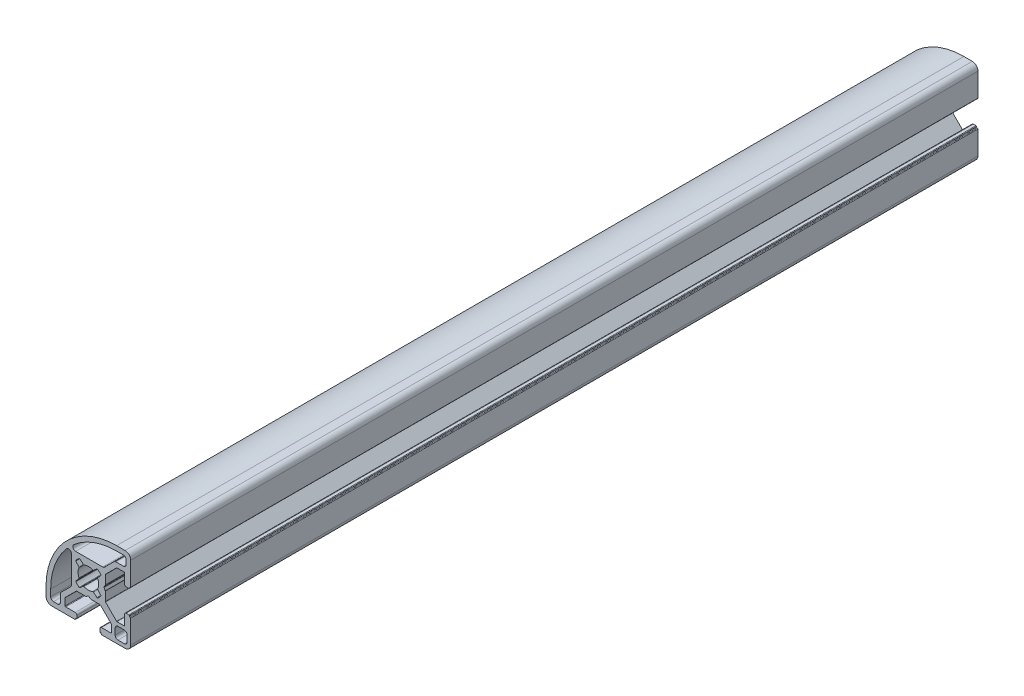
from build123d import *

# Parameters (mm, degrees)
EXTRUDE1_DEPTH = 300


with BuildPart() as part:
    # Sketch1 → Extrude1 (new body)
    with BuildSketch(Plane.XY):
        with BuildLine():
            Line((5.977671173, -0.853590033), (5.542585895, -0.100000184))
            ThreePointArc((5.542585895, -0.100000184), (5.515790979, -1.84e-07), (5.5425859, 0.099999816))
            Line((5.5425859, 0.099999816), (5.977671215, 0.853589644))
            ThreePointArc((5.977671215, 0.853589644), (5.9976513, 0.901825834), (6.004466136, 0.953589643))
            Line((6.004466136, 0.953589643), (6.004466136, 4.121623186))
            ThreePointArc((6.004466136, 4.121623186), (6.019690232, 4.198159872), (6.063044784, 4.263044541))
            Line((6.063044784, 4.263044541), (9.991421498, 8.191421063))
            ThreePointArc((9.991421498, 8.191421063), (10.056306169, 8.234775612), (10.132842855, 8.249999704))
            Line((10.132842855, 8.249999704), (12.600000143, 8.249999704))
            ThreePointArc((12.600000143, 8.249999704), (12.741421498, 8.191421057), (12.800000138, 8.049999699))
            Line((12.800000138, 8.049999699), (12.800000138, 4.649999699))
            ThreePointArc((12.800000138, 4.649999699), (12.975736059, 4.225735626), (13.400000123, 4.049999684))
            Line((13.400000123, 4.049999684), (14.300000123, 4.049999684))
            ThreePointArc((14.300000123, 4.049999684), (14.441421481, 4.108578325), (14.500000128, 4.249999679))
            Line((14.500000128, 4.249999679), (14.500000128, 4.349999679))
            ThreePointArc((14.500000128, 4.349999679), (14.558578775, 4.491421034), (14.700000133, 4.549999675))
            Line((14.700000133, 4.549999675), (14.800000133, 4.549999675))
            ThreePointArc((14.800000133, 4.549999675), (14.941421467, 4.608578371), (15.000000058, 4.749999749))
            Line((15.000000058, 4.749999749), (15.000000259, 12.999999749))
            ThreePointArc((15.000000259, 12.999999749), (14.414213856, 14.414213326), (13.000000308, 14.999999798))
            Line((13.000000308, 14.999999798), (10.000000308, 14.999999798))
            ThreePointArc((10.000000308, 14.999999798), (-7.6776694, 7.677669758), (-15.000000301, -9.999999593))
            Line((-15.000000301, -9.999999593), (-15.000000301, -12.999999593))
            ThreePointArc((-15.000000301, -12.999999593), (-14.414213898, -14.41421317), (-13.00000035, -14.999999642))
            Line((-13.00000035, -14.999999642), (-4.75000035, -14.999999843))
            ThreePointArc((-4.75000035, -14.999999843), (-4.608578992, -14.941421202), (-4.550000345, -14.799999848))
            Line((-4.550000345, -14.799999848), (-4.550000345, -14.699999848))
            ThreePointArc((-4.550000345, -14.699999848), (-4.491421698, -14.558578493), (-4.35000034, -14.499999852))
            Line((-4.35000034, -14.499999852), (-4.25000034, -14.499999852))
            ThreePointArc((-4.25000034, -14.499999852), (-4.108578982, -14.441421212), (-4.050000335, -14.299999857))
            Line((-4.050000335, -14.299999857), (-4.050000335, -13.399999857))
            ThreePointArc((-4.050000335, -13.399999857), (-4.225736256, -12.975735784), (-4.65000032, -12.799999843))
            Line((-4.65000032, -12.799999843), (-8.05000032, -12.799999843))
            ThreePointArc((-8.05000032, -12.799999843), (-8.191421675, -12.741421195), (-8.250000316, -12.599999838))
            Line((-8.250000316, -12.599999838), (-8.250000316, -10.13284255))
            ThreePointArc((-8.250000316, -10.13284255), (-8.23477622, -10.056305864), (-8.191421668, -9.991421195))
            Line((-8.191421668, -9.991421195), (-4.263044954, -6.063044673))
            ThreePointArc((-4.263044954, -6.063044673), (-4.198160283, -6.019690124), (-4.121623597, -6.004466032))
            Line((-4.121623597, -6.004466032), (-0.953590053, -6.004466032))
            ThreePointArc((-0.953590053, -6.004466032), (-0.901826244, -5.997651199), (-0.853590053, -5.977671116))
            Line((-0.853590053, -5.977671116), (-0.100000204, -5.542585838))
            ThreePointArc((-0.100000204, -5.542585838), (-2.03e-07, -5.515790921), (0.099999796, -5.542585843))
            Line((0.099999796, -5.542585843), (0.853589624, -5.977671157))
            ThreePointArc((0.853589624, -5.977671157), (0.901825815, -5.997651243), (0.953589624, -6.004466079))
            Line((0.953589624, -6.004466079), (4.121623167, -6.004466079))
            ThreePointArc((4.121623167, -6.004466079), (4.198159853, -6.019690174), (4.263044521, -6.063044726))
            Line((4.263044521, -6.063044726), (8.191421044, -9.99142144))
            ThreePointArc((8.191421044, -9.99142144), (8.234775593, -10.056306111), (8.249999684, -10.132842798))
            Line((8.249999684, -10.132842798), (8.249999684, -12.600000085))
            ThreePointArc((8.249999684, -12.600000085), (8.191421037, -12.74142144), (8.04999968, -12.800000081))
            Line((8.04999968, -12.800000081), (4.64999968, -12.800000081))
            ThreePointArc((4.64999968, -12.800000081), (4.225735607, -12.975736002), (4.049999665, -13.400000066))
            Line((4.049999665, -13.400000066), (4.049999665, -14.300000066))
            ThreePointArc((4.049999665, -14.300000066), (4.108578305, -14.441421424), (4.24999966, -14.500000071))
            Line((4.24999966, -14.500000071), (4.34999966, -14.500000071))
            ThreePointArc((4.34999966, -14.500000071), (4.491421015, -14.558578718), (4.549999655, -14.700000076))
            Line((4.549999655, -14.700000076), (4.549999655, -14.800000076))
            ThreePointArc((4.549999655, -14.800000076), (4.608578296, -14.941421433), (4.74999965, -15.000000081))
            Line((4.74999965, -15.000000081), (12.99999965, -15.000000282))
            ThreePointArc((12.99999965, -15.000000282), (14.414213227, -14.414213878), (14.999999699, -13.00000033))
            Line((14.999999699, -13.00000033), (14.9999999, -4.75000033))
            ThreePointArc((14.9999999, -4.75000033), (14.94142126, -4.608578973), (14.799999905, -4.550000325))
            Line((14.799999905, -4.550000325), (14.699999905, -4.550000325))
            ThreePointArc((14.699999905, -4.550000325), (14.55857855, -4.491421678), (14.49999991, -4.350000321))
            Line((14.49999991, -4.350000321), (14.49999991, -4.250000321))
            ThreePointArc((14.49999991, -4.250000321), (14.44142127, -4.108578963), (14.299999915, -4.050000316))
            Line((14.299999915, -4.050000316), (13.399999915, -4.050000316))
            ThreePointArc((13.399999915, -4.050000316), (12.975735842, -4.225736237), (12.7999999, -4.650000301))
            Line((12.7999999, -4.650000301), (12.7999999, -8.050000301))
            ThreePointArc((12.7999999, -8.050000301), (12.741421253, -8.191421656), (12.599999895, -8.250000296))
            Line((12.599999895, -8.250000296), (10.132842608, -8.250000296))
            ThreePointArc((10.132842608, -8.250000296), (10.056305922, -8.234776201), (9.991421253, -8.191421649))
            Line((9.991421253, -8.191421649), (6.06304473, -4.263044935))
            ThreePointArc((6.06304473, -4.263044935), (6.019690182, -4.198160264), (6.00446609, -4.121623577))
            Line((6.00446609, -4.121623577), (6.00446609, -0.953590034))
            ThreePointArc((6.00446609, -0.953590034), (5.997651256, -0.901826225), (5.977671173, -0.853590033))
        make_face()
        with BuildLine():
            Line((-5.995534092, -5.047867784), (-5.995533859, 4.51462478))
            ThreePointArc((-5.995533859, 4.51462478), (-6.649431664, 5.452821624), (-7.755960416, 5.164048743))
            ThreePointArc((-7.755960416, 5.164048743), (-11.906896027, -1.918513974), (-13.350000301, -9.999999675))
            Line((-13.350000301, -9.999999675), (-13.350000301, -12.349999675))
            ThreePointArc((-13.350000301, -12.349999675), (-13.057107099, -13.057106463), (-12.350000325, -13.349999699))
            Line((-12.350000325, -13.349999699), (-10.900000325, -13.349999699))
            ThreePointArc((-10.900000325, -13.349999699), (-10.192893537, -13.057106498), (-9.900000301, -12.349999723))
            Line((-9.900000301, -12.349999723), (-9.900000301, -9.780760908))
            ThreePointArc((-9.900000301, -9.780760908), (-9.823879824, -9.398077477), (-9.607107065, -9.073654134))
            Line((-9.607107065, -9.073654134), (-6.288427328, -5.754974558))
            ThreePointArc((-6.288427328, -5.754974558), (-6.071654568, -5.430551215), (-5.995534092, -5.047867784))
        make_face(mode=Mode.SUBTRACT)
        with BuildLine():
            Line((13.350000208, 10.899999779), (13.350000208, 12.349999779))
            ThreePointArc((13.350000208, 12.349999779), (13.057107017, 13.057106551), (12.350000268, 13.349999798))
            Line((12.350000268, 13.349999798), (10.000000268, 13.349999798))
            ThreePointArc((10.000000268, 13.349999798), (1.918514515, 11.906895909), (-5.164048387, 7.755960646))
            ThreePointArc((-5.164048387, 7.755960646), (-5.452821321, 6.649431908), (-4.51462451, 5.995534058))
            Line((-4.51462451, 5.995534058), (5.047868054, 5.995533825))
            ThreePointArc((5.047868054, 5.995533825), (5.430551489, 6.071654283), (5.754974843, 6.288427026))
            Line((5.754974843, 6.288427026), (9.07365458, 9.607106602))
            ThreePointArc((9.07365458, 9.607106602), (9.398077934, 9.823879345), (9.780761368, 9.899999803))
            Line((9.780761368, 9.899999803), (12.350000184, 9.899999803))
            ThreePointArc((12.350000184, 9.899999803), (13.057106972, 10.192893005), (13.350000208, 10.899999779))
        make_face(mode=Mode.SUBTRACT)
        with BuildLine():
            Line((13.699999744, -10.50000028), (13.699999744, -12.70000028))
            ThreePointArc((13.699999744, -12.70000028), (13.407106508, -13.407107054), (12.69999972, -13.700000256))
            Line((12.69999972, -13.700000256), (10.49999972, -13.700000256))
            ThreePointArc((10.49999972, -13.700000256), (9.792892946, -13.40710702), (9.499999744, -12.700000231))
            Line((9.499999744, -12.700000231), (9.499999744, -10.500000231))
            ThreePointArc((9.499999744, -10.500000231), (9.79289298, -9.792893457), (10.499999769, -9.500000256))
            Line((10.499999769, -9.500000256), (12.699999769, -9.500000256))
            ThreePointArc((12.699999769, -9.500000256), (13.407106543, -9.792893492), (13.699999744, -10.50000028))
        make_face(mode=Mode.SUBTRACT)
        with BuildLine():
            Line((-3.334407305, 1.759211763), (-4.405223013, 3.035360293))
            ThreePointArc((-4.405223013, 3.035360293), (-4.45192881, 3.158076825), (-4.412467484, 3.283310936))
            ThreePointArc((-4.412467484, 3.283310936), (-3.889087202, 3.889087391), (-3.283310721, 4.412467644))
            ThreePointArc((-3.283310721, 4.412467644), (-3.158076608, 4.451928964), (-3.035360078, 4.405223161))
            Line((-3.035360078, 4.405223161), (-1.7592116, 3.334407391))
            ThreePointArc((-1.7592116, 3.334407391), (-1.656657743, 3.289313958), (-1.545944772, 3.306441405))
            ThreePointArc((-1.545944772, 3.306441405), (8.9e-08, 3.65), (1.545944933, 3.306441329))
            ThreePointArc((1.545944933, 3.306441329), (1.656657903, 3.289313878), (1.759211763, 3.334407305))
            Line((1.759211763, 3.334407305), (3.035360293, 4.405223013))
            ThreePointArc((3.035360293, 4.405223013), (3.158076825, 4.45192881), (3.283310936, 4.412467484))
            ThreePointArc((3.283310936, 4.412467484), (3.889087391, 3.889087202), (4.412467644, 3.283310721))
            ThreePointArc((4.412467644, 3.283310721), (4.451928964, 3.158076608), (4.405223161, 3.035360078))
            Line((4.405223161, 3.035360078), (3.334407391, 1.7592116))
            ThreePointArc((3.334407391, 1.7592116), (3.289313958, 1.656657743), (3.306441405, 1.545944772))
            ThreePointArc((3.306441405, 1.545944772), (3.65, -8.9e-08), (3.306441329, -1.545944933))
            ThreePointArc((3.306441329, -1.545944933), (3.289313878, -1.656657903), (3.334407305, -1.759211763))
            Line((3.334407305, -1.759211763), (4.405223013, -3.035360293))
            ThreePointArc((4.405223013, -3.035360293), (4.45192881, -3.158076825), (4.412467484, -3.283310936))
            ThreePointArc((4.412467484, -3.283310936), (3.889087202, -3.889087391), (3.283310721, -4.412467644))
            ThreePointArc((3.283310721, -4.412467644), (3.158076608, -4.451928964), (3.035360078, -4.405223161))
            Line((3.035360078, -4.405223161), (1.7592116, -3.334407391))
            ThreePointArc((1.7592116, -3.334407391), (1.656657743, -3.289313958), (1.545944772, -3.306441405))
            ThreePointArc((1.545944772, -3.306441405), (-8.9e-08, -3.65), (-1.545944933, -3.306441329))
            ThreePointArc((-1.545944933, -3.306441329), (-1.656657903, -3.289313878), (-1.759211763, -3.334407305))
            Line((-1.759211763, -3.334407305), (-3.035360293, -4.405223013))
            ThreePointArc((-3.035360293, -4.405223013), (-3.158076825, -4.45192881), (-3.283310936, -4.412467484))
            ThreePointArc((-3.283310936, -4.412467484), (-3.889087391, -3.889087202), (-4.412467644, -3.283310721))
            ThreePointArc((-4.412467644, -3.283310721), (-4.451928964, -3.158076608), (-4.405223161, -3.035360078))
            Line((-4.405223161, -3.035360078), (-3.334407391, -1.7592116))
            ThreePointArc((-3.334407391, -1.7592116), (-3.289313958, -1.656657743), (-3.306441405, -1.545944772))
            ThreePointArc((-3.306441405, -1.545944772), (-3.65, 8.9e-08), (-3.306441329, 1.545944933))
            ThreePointArc((-3.306441329, 1.545944933), (-3.289313878, 1.656657903), (-3.334407305, 1.759211763))
        make_face(mode=Mode.SUBTRACT)
    extrude(amount=EXTRUDE1_DEPTH)


solid = part.part
